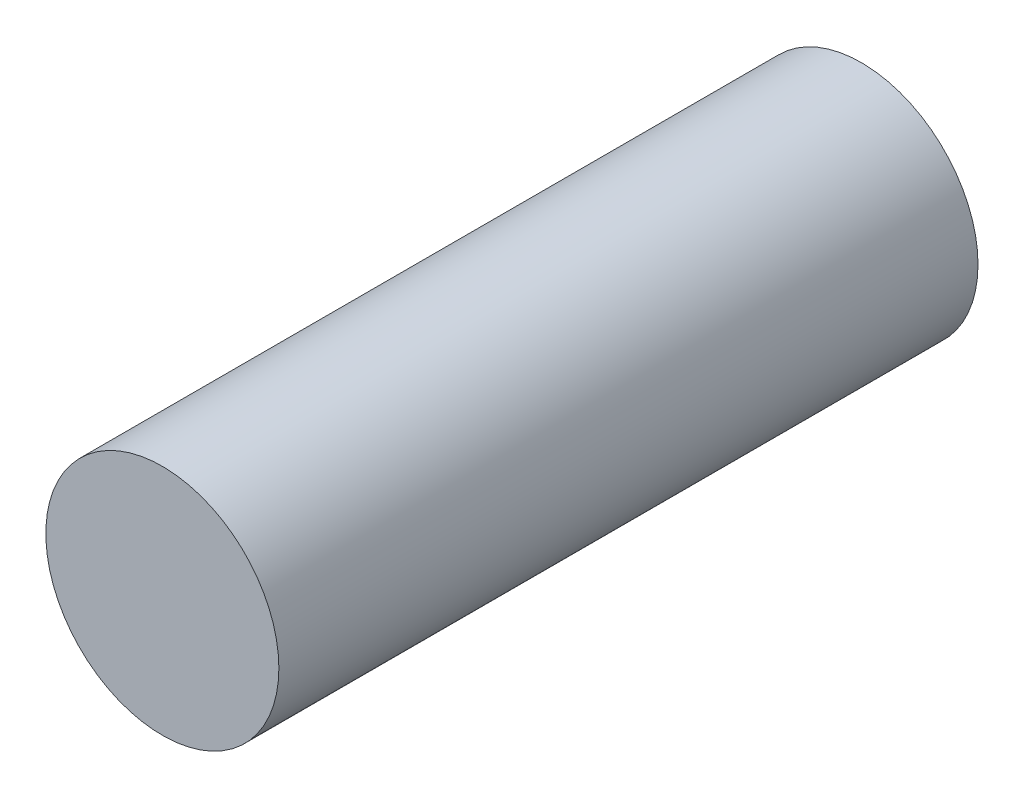
from build123d import *

# Parameters (mm, degrees)
SKETCH1_R           = 5
BOSS_EXTRUDE1_DEPTH = 30
SKETCH2_R           = 1.75
CUT_EXTRUDE1_DEPTH  = 1


with BuildPart() as part:
    # Sketch1 → Boss-Extrude1 (new body)
    with BuildSketch(Plane.XY):
        Circle(SKETCH1_R)
    extrude(amount=BOSS_EXTRUDE1_DEPTH)

    # Sketch2 → Cut-Extrude1 (cut)
    with BuildSketch(Plane(origin=(0, 0, 0), x_dir=(-1, 0, 0), z_dir=(0, 0, -1))):
        Circle(SKETCH2_R)
    extrude(amount=-CUT_EXTRUDE1_DEPTH, mode=Mode.SUBTRACT)


solid = part.part
